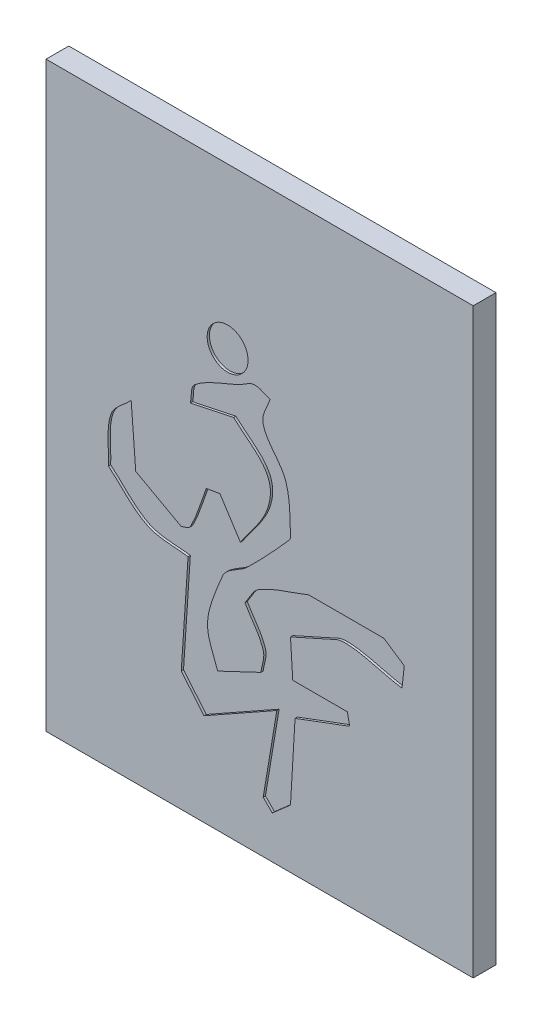
from build123d import *

# Parameters (mm, degrees)
ESQUISSE2_W             = 187.693077266
ESQUISSE2_H             = 255.801785532
BOSS_EXTRU_1_DEPTH      = 10
ESQUISSE1_R             = 8.980927744
ENL_V_MAT_EXTRU_1_DEPTH = 1


with BuildPart() as part:
    # Esquisse2 → Boss.-Extru.1 (new body)
    with BuildSketch(Plane.XY):
        Rectangle(ESQUISSE2_W, ESQUISSE2_H)
    extrude(amount=-BOSS_EXTRU_1_DEPTH)

    # Esquisse1 → Enlèv. mat.-Extru.1 (cut)
    with BuildSketch(Plane.XY):
        with Locations((-14.068497164, 57.651010039)):
            Circle(ESQUISSE1_R)
        with BuildLine():
            Line((-18.438094574, -67.249269982), (0.561905426, -58.249269982))
            add(Edge.make_bspline(
                [(0.561905426, -58.249269982), (0.895238759, -55.249269982), (2.440765615, -52.136953462), (1.561905426, -49.249269982), (-0.003041236, -44.107302379), (-3.771427907, -39.915936649), (-6.438094574, -35.249269982)],
                knots=[0, 0, 0, 0, 1, 1, 1, 2, 2, 2, 2], degree=3))
            add(Edge.make_bspline(
                [(-6.438094574, -35.249269982), (-4.438094574, -32.582603316), (-3.287386291, -28.979197096), (-0.438094574, -27.249269982), (6.334594522, -23.137280174), (14.228572093, -21.249269982), (21.561905426, -18.249269982)],
                knots=[0, 0, 0, 0, 1, 1, 1, 2, 2, 2, 2], degree=3))
            Line((21.561905426, -18.249269982), (54.561905426, -18.249269982))
            Line((54.561905426, -18.249269982), (63.561905426, -24.249269982))
            Line((63.561905426, -24.249269982), (62.561905426, -33.249269982))
            add(Edge.make_bspline(
                [(62.561905426, -33.249269982), (54.348122416, -32.222547106), (39.619427755, -26.495850742), (33.561905426, -29.249269982), (26.906606899, -32.274405676), (20.228572093, -35.249269982), (13.561905426, -38.249269982)],
                knots=[0, 0, 0, 0, 1, 1, 1, 2, 2, 2, 2], degree=3))
            Line((13.561905426, -38.249269982), (14.561905426, -54.249269982))
            Line((14.561905426, -54.249269982), (38.561905426, -54.249269982))
            Line((38.561905426, -54.249269982), (39.561905426, -59.249269982))
            Line((39.561905426, -59.249269982), (15.561905426, -68.249269982))
            Line((15.561905426, -68.249269982), (13.561905426, -102.249269982))
            Line((13.561905426, -102.249269982), (5.561905426, -109.249269982))
            Line((5.561905426, -109.249269982), (1.561905426, -105.249269982))
            Line((1.561905426, -105.249269982), (7.561905426, -69.249269982))
            Line((7.561905426, -69.249269982), (-24.438094574, -87.249269982))
            Line((-24.438094574, -87.249269982), (-34.438094574, -75.249269982))
            Line((-34.438094574, -75.249269982), (-31.438094574, -30.249269982))
            add(Edge.make_bspline(
                [(-31.438094574, -30.249269982), (-37.438094574, -29.249269982), (-43.966600051, -29.906853036), (-49.438094574, -27.249269982), (-56.041298676, -24.041999418), (-60.771427907, -17.915936649), (-66.438094574, -13.249269982)],
                knots=[0, 0, 0, 0, 1, 1, 1, 2, 2, 2, 2], degree=3))
            add(Edge.make_bspline(
                [(-66.438094574, -13.249269982), (-66.104761241, -6.582603316), (-67.548913267, 0.418273938), (-65.438094574, 6.750730018), (-64.019958082, 11.005139495), (-59.438094574, 13.417396684), (-56.438094574, 16.750730018)],
                knots=[0, 0, 0, 0, 1, 1, 1, 2, 2, 2, 2], degree=3))
            Line((-56.438094574, 16.750730018), (-54.438094574, -9.249269982))
            Line((-54.438094574, -9.249269982), (-34.438094574, -20.249269982))
            add(Edge.make_bspline(
                [(-34.438094574, -20.249269982), (-33.104761241, -19.582603316), (-31.15649663, -19.555455539), (-30.438094574, -18.249269982), (-27.335628903, -12.608423308), (-25.771427907, -6.249269982), (-23.438094574, -0.249269982)],
                knots=[0, 0, 0, 0, 1, 1, 1, 2, 2, 2, 2], degree=3))
            Line((-23.438094574, -0.249269982), (-17.438094574, 0.750730018))
            Line((-17.438094574, 0.750730018), (-8.438094574, -13.249269982))
            add(Edge.make_bspline(
                [(-8.438094574, -13.249269982), (-4.438094574, -6.915936649), (1.193127025, -1.355605184), (3.561905426, 5.750730018), (8.39884273, 20.261541929), (-2.572357609, 24.518259979), (-11.438094574, 32.750730018)],
                knots=[0, 0, 0, 0, 1, 1, 1, 2, 2, 2, 2], degree=3))
            Line((-11.438094574, 32.750730018), (-30.438094574, 28.750730018))
            add(Edge.make_bspline(
                [(-30.438094574, 28.750730018), (-29.771427907, 31.417396684), (-30.565499704, 35.010125821), (-28.438094574, 36.750730018), (-22.669357465, 41.470605834), (-15.104761241, 43.417396684), (-8.438094574, 46.750730018), (-6.438094574, 47.750730018), (-4.667576181, 49.579231433), (-2.438094574, 49.750730018), (-0.018539167, 49.936849664), (2.228572093, 48.417396684), (4.561905426, 47.750730018)],
                knots=[0, 0, 0, 0, 1, 1, 1, 2, 2, 2, 3, 3, 3, 4, 4, 4, 4], degree=3))
            add(Edge.make_bspline(
                [(4.561905426, 47.750730018), (3.561905426, 44.084063351), (0.640128228, 40.437838809), (1.561905426, 36.750730018), (3.156422174, 30.372663025), (9.533684179, 26.004412197), (11.561905426, 19.750730018), (13.628861322, 13.377616005), (13.257677863, 6.443736403), (13.561905426, -0.249269982), (13.595750298, -0.99385717), (13.061974693, -1.696561846), (12.561905426, -2.249269982), (6.708744727, -8.71855286), (0.838084785, -15.189510601), (-5.438094574, -21.249269982), (-8.846299856, -24.539950945), (-14.599652494, -25.882970043), (-16.438094574, -30.249269982), (-25.647412644, -52.121400398), (-23.800738795, -52.948885392), (-18.438094574, -67.249269982)],
                knots=[0, 0, 0, 0, 1, 1, 1, 2, 2, 2, 3, 3, 3, 4, 4, 4, 5, 5, 5, 6, 6, 6, 7, 7, 7, 7], degree=3))
        make_face()
    extrude(amount=-ENL_V_MAT_EXTRU_1_DEPTH, mode=Mode.SUBTRACT)


solid = part.part
